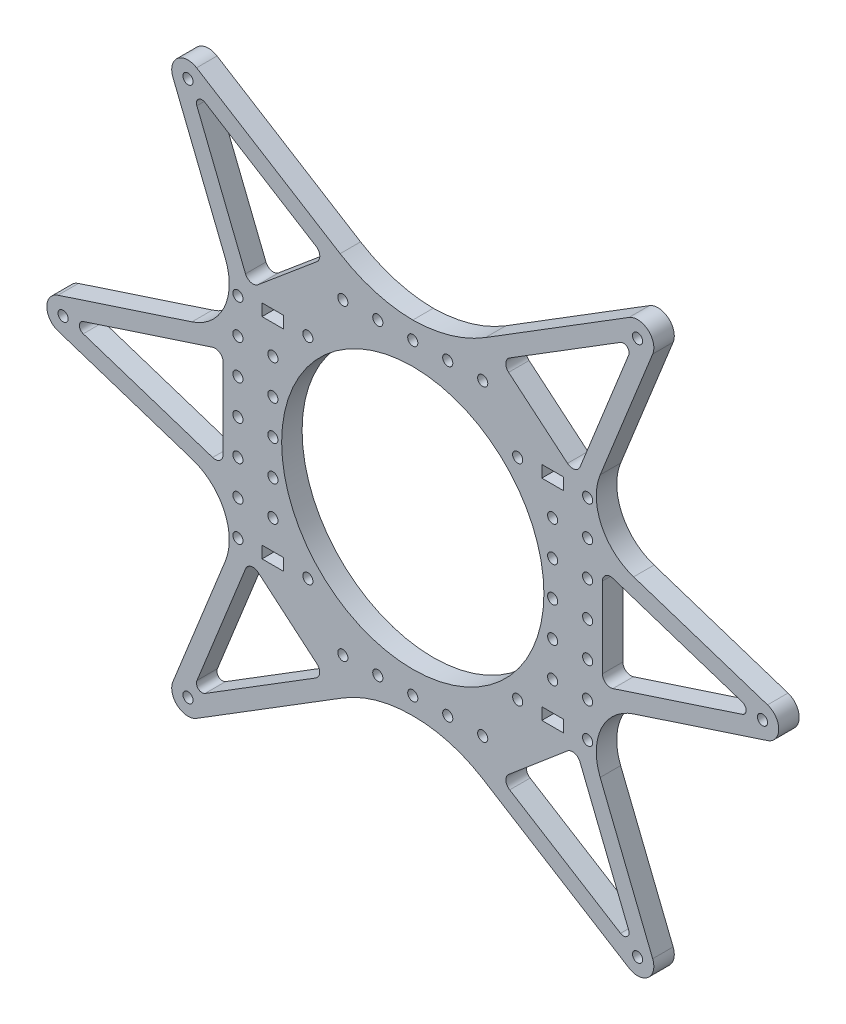
from build123d import *

# Parameters (mm, degrees)
SKETCH1_R           = 1.450000006
SKETCH1_R_2         = 1.45
SKETCH1_R_3         = 37.5
SKETCH1_W           = 6.2
SKETCH1_H           = 3.4
BOSS_EXTRUDE1_DEPTH = 5.85


with BuildPart() as part:
    # Sketch1 → Boss-Extrude1 (new body)
    with BuildSketch(Plane.XY):
        with BuildLine():
            Line((587.995290395, 497.753361998), (603.001149052, 460.347016836))
            ThreePointArc((603.001149052, 460.347016836), (602.663461243, 448.032016356), (593.446685098, 439.857402764))
            Line((593.446685098, 439.857402764), (555.146182231, 427.30822221))
            ThreePointArc((555.146182231, 427.30822221), (551.939243509, 422.882775531), (555.146182231, 418.457328853))
            Line((555.146182231, 418.457328853), (593.451704621, 405.906503648))
            ThreePointArc((593.451704621, 405.906503648), (602.672646523, 397.727172938), (603.008211739, 385.405865524))
            Line((603.008211739, 385.405865524), (587.996899243, 348.012788825))
            ThreePointArc((587.996899243, 348.012788825), (589.323611121, 342.712892318), (594.773109373, 342.32297413))
            Line((594.773109373, 342.32297413), (636.531879216, 368.248955529))
            ThreePointArc((636.531879216, 368.248955529), (646.164378733, 372.489187309), (656.596182238, 373.882775531))
            ThreePointArc((656.596182238, 373.882775531), (667.027985743, 372.489187309), (676.66048526, 368.248955529))
            Line((676.66048526, 368.248955529), (718.419255103, 342.32297413))
            ThreePointArc((718.419255103, 342.32297413), (723.868753355, 342.712892318), (725.195465233, 348.012788825))
            Line((725.195465233, 348.012788825), (710.184152737, 385.405865524))
            ThreePointArc((710.184152737, 385.405865524), (710.519717953, 397.727172938), (719.740659854, 405.906503648))
            Line((719.740659854, 405.906503648), (758.046182244, 418.457328853))
            ThreePointArc((758.046182244, 418.457328853), (761.253120966, 422.882775531), (758.046182244, 427.30822221))
            Line((758.046182244, 427.30822221), (719.745679378, 439.857402764))
            ThreePointArc((719.745679378, 439.857402764), (710.528903233, 448.032016356), (710.191215423, 460.347016836))
            Line((710.191215423, 460.347016836), (725.197074081, 497.753361998))
            ThreePointArc((725.197074081, 497.753361998), (723.86836572, 503.054641878), (718.416896408, 503.442606583))
            Line((718.416896408, 503.442606583), (677.369935548, 477.934266348))
            ThreePointArc((677.369935548, 477.934266348), (667.39800528, 473.484079569), (656.596182238, 471.882775531))
            ThreePointArc((656.596182238, 471.882775531), (645.794359196, 473.484079569), (635.822428927, 477.934266348))
            Line((635.822428927, 477.934266348), (594.775468067, 503.442606583))
            ThreePointArc((594.775468067, 503.442606583), (589.323998755, 503.054641878), (587.995290395, 497.753361998))
        make_face()
        with Locations((592.317421269, 499.487219843)):
            Circle(SKETCH1_R, mode=Mode.SUBTRACT)
        with Locations(Location((706.596182238, 432.882775531, 0), (0, 0, 180))):
            Circle(SKETCH1_R_2, mode=Mode.SUBTRACT)
        with Locations(Location((706.596182238, 442.882775531, 0), (0, 0, 180))):
            Circle(SKETCH1_R_2, mode=Mode.SUBTRACT)
        with Locations(Location((706.596182238, 452.882775531, 0), (0, 0, 180))):
            Circle(SKETCH1_R_2, mode=Mode.SUBTRACT)
        with Locations((706.596182238, 392.882775531)):
            Circle(SKETCH1_R_2, mode=Mode.SUBTRACT)
        with Locations((556.596182238, 422.882775531)):
            Circle(SKETCH1_R, mode=Mode.SUBTRACT)
        with Locations(Location((646.596182238, 378.882775531, 0), (0, 0, 180))):
            Circle(SKETCH1_R_2, mode=Mode.SUBTRACT)
        with Locations((656.596182238, 422.882775531)):
            Circle(SKETCH1_R_3, mode=Mode.SUBTRACT)
        with Locations(Location((636.596182238, 378.882775531, 0), (0, 0, 180))):
            Circle(SKETCH1_R_2, mode=Mode.SUBTRACT)
        with Locations((706.596182238, 402.882775531)):
            Circle(SKETCH1_R_2, mode=Mode.SUBTRACT)
        with Locations((656.596182238, 466.882775531)):
            Circle(SKETCH1_R_2, mode=Mode.SUBTRACT)
        with Locations(Location((696.596182238, 432.882775531, 0), (0, 0, 180))):
            Circle(SKETCH1_R_2, mode=Mode.SUBTRACT)
        with Locations((592.317421269, 346.278331219)):
            Circle(SKETCH1_R, mode=Mode.SUBTRACT)
        with Locations((706.596182238, 412.882775531)):
            Circle(SKETCH1_R_2, mode=Mode.SUBTRACT)
        with Locations(Location((656.596182238, 378.882775531, 0), (0, 0, 180))):
            Circle(SKETCH1_R_2, mode=Mode.SUBTRACT)
        with Locations(Location((696.596182238, 442.882775531, 0), (0, 0, 180))):
            Circle(SKETCH1_R_2, mode=Mode.SUBTRACT)
        with Locations((696.596182238, 402.882775531)):
            Circle(SKETCH1_R_2, mode=Mode.SUBTRACT)
        with Locations((696.596182238, 412.882775531)):
            Circle(SKETCH1_R_2, mode=Mode.SUBTRACT)
        with Locations((646.596182238, 466.882775531)):
            Circle(SKETCH1_R_2, mode=Mode.SUBTRACT)
        with Locations((636.596182238, 466.882775531)):
            Circle(SKETCH1_R_2, mode=Mode.SUBTRACT)
        with Locations(Location((696.596182238, 422.882775531, 0), (0, 0, 180))):
            Circle(SKETCH1_R_2, mode=Mode.SUBTRACT)
        with Locations(Location((676.596182238, 466.882775531, 0), (0, 0, 180))):
            Circle(SKETCH1_R_2, mode=Mode.SUBTRACT)
        with Locations(Location((666.596182238, 466.882775531, 0), (0, 0, 180))):
            Circle(SKETCH1_R_2, mode=Mode.SUBTRACT)
        with Locations(Location((706.596182238, 422.882775531, 0), (0, 0, 180))):
            Circle(SKETCH1_R_2, mode=Mode.SUBTRACT)
        with Locations(Location((686.596182238, 452.882775531, 0), (0, 0, 180))):
            Circle(SKETCH1_R_2, mode=Mode.SUBTRACT)
        with Locations((686.596182238, 392.882775531)):
            Circle(SKETCH1_R_2, mode=Mode.SUBTRACT)
        with Locations(Location((626.596182238, 392.882775531, 0), (0, 0, 180))):
            Circle(SKETCH1_R_2, mode=Mode.SUBTRACT)
        with Locations(Location((720.874943207, 346.278331219, 0), (0, 0, 180))):
            Circle(SKETCH1_R, mode=Mode.SUBTRACT)
        with Locations((676.596182238, 378.882775531)):
            Circle(SKETCH1_R_2, mode=Mode.SUBTRACT)
        with Locations((666.596182238, 378.882775531)):
            Circle(SKETCH1_R_2, mode=Mode.SUBTRACT)
        with Locations(Location((756.596182238, 422.882775531, 0), (0, 0, 180))):
            Circle(SKETCH1_R, mode=Mode.SUBTRACT)
        with Locations((626.596182238, 452.882775531)):
            Circle(SKETCH1_R_2, mode=Mode.SUBTRACT)
        with Locations((606.596182238, 422.882775531)):
            Circle(SKETCH1_R_2, mode=Mode.SUBTRACT)
        with Locations((616.596182238, 422.882775531)):
            Circle(SKETCH1_R_2, mode=Mode.SUBTRACT)
        with Locations(Location((616.596182238, 412.882775531, 0), (0, 0, 180))):
            Circle(SKETCH1_R_2, mode=Mode.SUBTRACT)
        with Locations(Location((720.874943207, 499.487219843, 0), (0, 0, 180))):
            Circle(SKETCH1_R, mode=Mode.SUBTRACT)
        with Locations(Location((616.596182238, 402.882775531, 0), (0, 0, 180))):
            Circle(SKETCH1_R_2, mode=Mode.SUBTRACT)
        with Locations((616.596182238, 442.882775531)):
            Circle(SKETCH1_R_2, mode=Mode.SUBTRACT)
        with Locations(Location((606.596182238, 412.882775531, 0), (0, 0, 180))):
            Circle(SKETCH1_R_2, mode=Mode.SUBTRACT)
        with Locations((616.596182238, 432.882775531)):
            Circle(SKETCH1_R_2, mode=Mode.SUBTRACT)
        with Locations(Location((606.596182238, 402.882775531, 0), (0, 0, 180))):
            Circle(SKETCH1_R_2, mode=Mode.SUBTRACT)
        with Locations(Location((606.596182238, 392.882775531, 0), (0, 0, 180))):
            Circle(SKETCH1_R_2, mode=Mode.SUBTRACT)
        with Locations((606.596182238, 452.882775531)):
            Circle(SKETCH1_R_2, mode=Mode.SUBTRACT)
        with Locations((606.596182238, 442.882775531)):
            Circle(SKETCH1_R_2, mode=Mode.SUBTRACT)
        with Locations((606.596182238, 432.882775531)):
            Circle(SKETCH1_R_2, mode=Mode.SUBTRACT)
        with BuildLine():
            Line((594.852213644, 494.089955534), (608.761050105, 459.418248349))
            ThreePointArc((608.761050105, 459.418248349), (610.328090614, 458.05093997), (612.354775393, 458.517520045))
            Line((612.354775393, 458.517520045), (629.185249241, 472.639964443))
            ThreePointArc((629.185249241, 472.639964443), (629.996671034, 474.554838547), (628.922248871, 476.335502797))
            Line((628.922248871, 476.335502797), (597.192526929, 496.053711548))
            ThreePointArc((597.192526929, 496.053711548), (595.310843783, 495.919797808), (594.852213644, 494.089955534))
        make_face(mode=Mode.SUBTRACT)
        with Locations((696.596182238, 392.882775531)):
            Rectangle(SKETCH1_W, SKETCH1_H, mode=Mode.SUBTRACT)
        with BuildLine():
            Line((562.360059701, 421.35524452), (599.360059701, 409.232174436))
            ThreePointArc((599.360059701, 409.232174436), (601.41475291, 409.553708225), (602.360059701, 411.406150729))
            Line((602.360059701, 411.406150729), (602.360059701, 434.359400333))
            ThreePointArc((602.360059701, 434.359400333), (601.41475291, 436.211842837), (599.360059701, 436.533376627))
            Line((599.360059701, 436.533376627), (562.360059701, 424.410306542))
            ThreePointArc((562.360059701, 424.410306542), (561.253120966, 422.882775531), (562.360059701, 421.35524452))
        make_face(mode=Mode.SUBTRACT)
        with BuildLine():
            Line((594.897239667, 351.78038038), (608.794032765, 386.397196889))
            ThreePointArc((608.794032765, 386.397196889), (610.36130643, 387.761102695), (612.3843749, 387.288049044))
            Line((612.3843749, 387.288049044), (629.156141394, 373.086154531))
            ThreePointArc((629.156141394, 373.086154531), (629.961681006, 371.166639364), (628.883661612, 369.385823055))
            Line((628.883661612, 369.385823055), (597.19261369, 349.710398658))
            ThreePointArc((597.19261369, 349.710398658), (595.266724956, 349.882452422), (594.897239667, 351.78038038))
        make_face(mode=Mode.SUBTRACT)
        with Locations((616.596182238, 452.882775531)):
            Rectangle(SKETCH1_W, SKETCH1_H, mode=Mode.SUBTRACT)
        with Locations((696.596182238, 452.882775531)):
            Rectangle(SKETCH1_W, SKETCH1_H, mode=Mode.SUBTRACT)
        with BuildLine():
            Line((715.999750786, 349.710398658), (684.308702864, 369.385823055))
            ThreePointArc((684.308702864, 369.385823055), (683.230683469, 371.166639364), (684.036223082, 373.086154531))
            Line((684.036223082, 373.086154531), (700.807989576, 387.288049044))
            ThreePointArc((700.807989576, 387.288049044), (702.831058046, 387.761102695), (704.39833171, 386.397196889))
            Line((704.39833171, 386.397196889), (718.295124809, 351.78038038))
            ThreePointArc((718.295124809, 351.78038038), (717.92563952, 349.882452422), (715.999750786, 349.710398658))
        make_face(mode=Mode.SUBTRACT)
        with BuildLine():
            Line((750.832304774, 424.410306542), (713.832304774, 436.533376627))
            ThreePointArc((713.832304774, 436.533376627), (711.777611566, 436.211842837), (710.832304774, 434.359400333))
            Line((710.832304774, 434.359400333), (710.832304774, 411.406150729))
            ThreePointArc((710.832304774, 411.406150729), (711.777611565, 409.553708225), (713.832304774, 409.232174436))
            Line((713.832304774, 409.232174436), (750.832304774, 421.35524452))
            ThreePointArc((750.832304774, 421.35524452), (751.939243509, 422.882775531), (750.832304774, 424.410306542))
        make_face(mode=Mode.SUBTRACT)
        with BuildLine():
            Line((684.007115235, 472.639964443), (700.837589083, 458.517520045))
            ThreePointArc((700.837589083, 458.517520045), (702.864273862, 458.05093997), (704.431314371, 459.418248349))
            Line((704.431314371, 459.418248349), (718.340150832, 494.089955534))
            ThreePointArc((718.340150832, 494.089955534), (717.881520693, 495.919797808), (715.999837547, 496.053711548))
            Line((715.999837547, 496.053711548), (684.270115605, 476.335502797))
            ThreePointArc((684.270115605, 476.335502797), (683.195693441, 474.554838547), (684.007115235, 472.639964443))
        make_face(mode=Mode.SUBTRACT)
        with Locations((616.596182238, 392.882775531)):
            Rectangle(SKETCH1_W, SKETCH1_H, mode=Mode.SUBTRACT)
    extrude(amount=BOSS_EXTRUDE1_DEPTH)


solid = part.part
